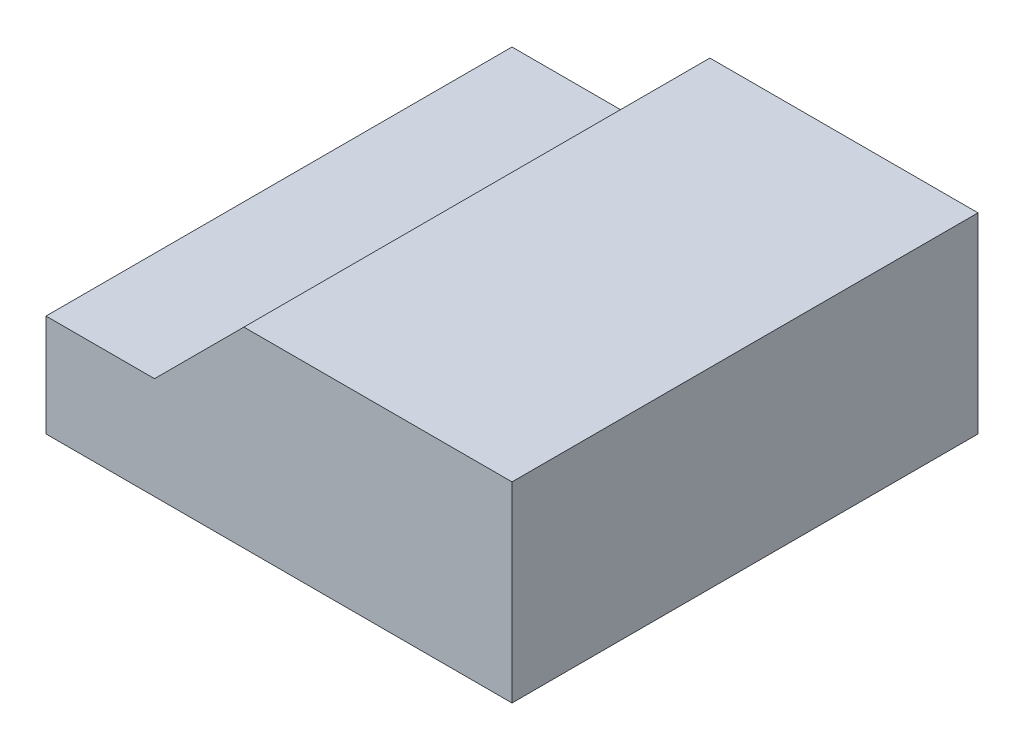
from build123d import *

# Parameters (mm, degrees)
BOSS_EXTRUDE1_DEPTH = 36.5


with BuildPart() as part:
    # Sketch1 → Boss-Extrude1 (new, symmetric)
    with BuildSketch(Plane.XY):
        Polygon((-36.5, -15), (36.5, -15), (36.5, 15), (-5.5, 15), (-19.5, 1), (-36.5, 1), align=None)
    extrude(amount=BOSS_EXTRUDE1_DEPTH, both=True)


solid = part.part
